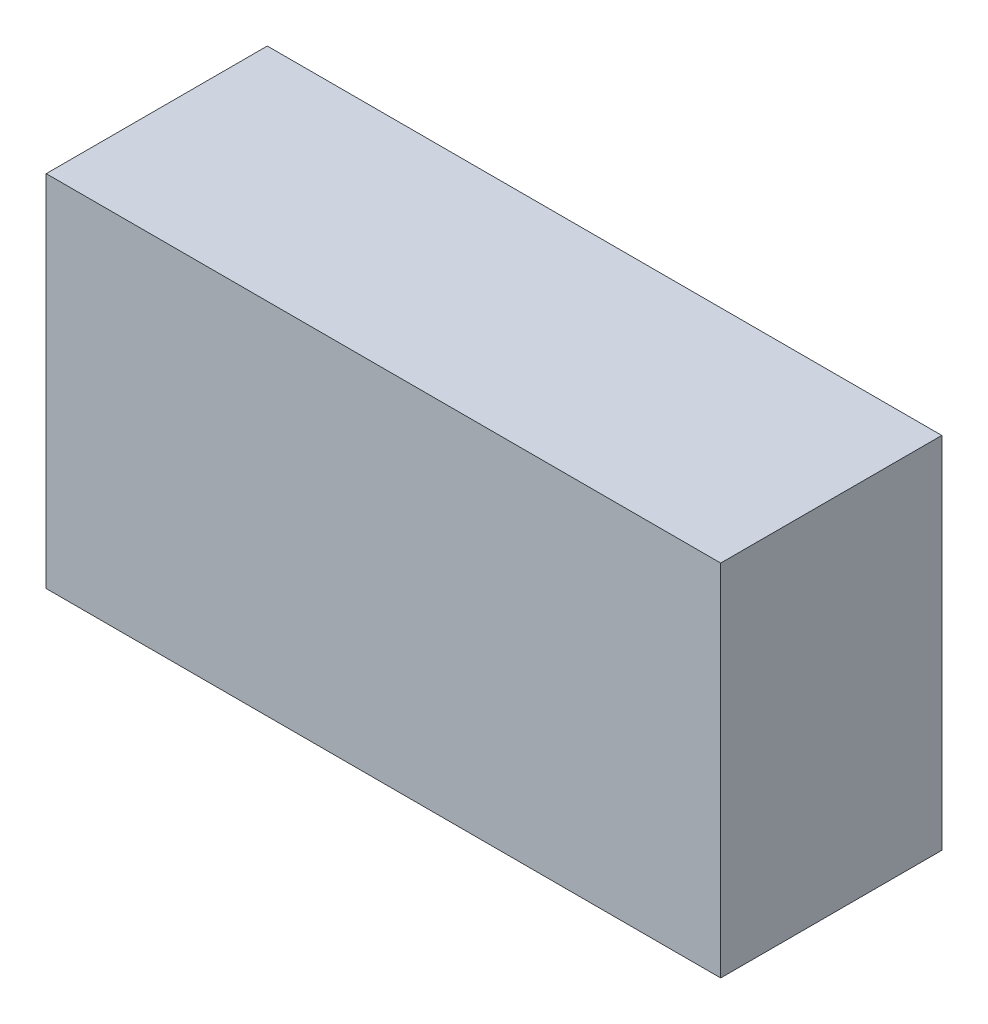
from build123d import *

# Parameters (mm, degrees)
SKETCH1_W               = 3.0508
SKETCH1_H               = 1.6254
COMPONENT_OUTLINE_DEPTH = 1


with BuildPart() as part:
    # Sketch1 → Component_Outline (new body)
    with BuildSketch(Plane.XY):
        with Locations((0, 0.0127)):
            Rectangle(SKETCH1_W, SKETCH1_H)
    extrude(amount=COMPONENT_OUTLINE_DEPTH)


solid = part.part
